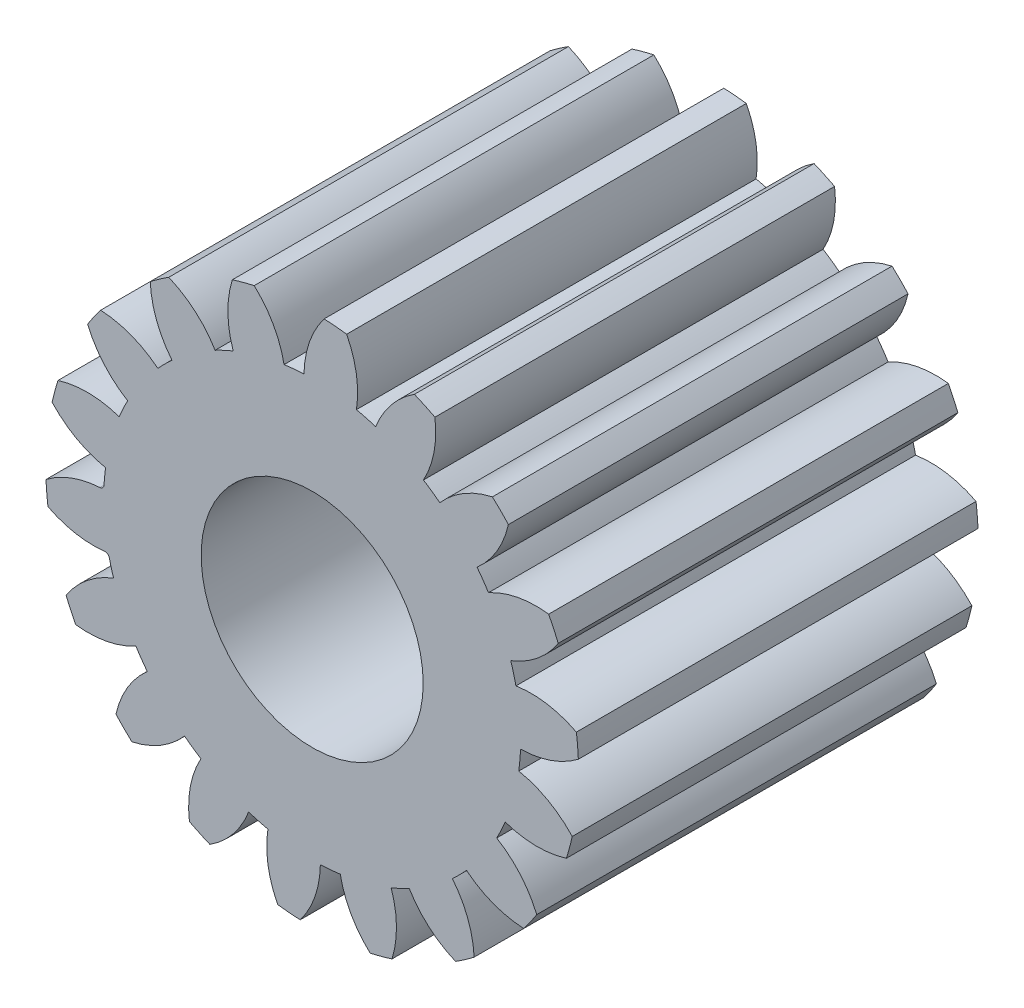
from build123d import *

# Parameters (mm, degrees)
BOSS_EXTRUDE3_DEPTH = 45
SKETCH2_R           = 23.476416667
BOSS_EXTRUDE4_DEPTH = 45
FILLET1_R           = 0.5
FILLET3_R           = 0.5
CIRPATTERN1_COUNT   = 18
SKETCH6_R           = 12.5
CUT_EXTRUDE1_DEPTH  = 45


with BuildPart() as part:
    # Sketch5 → Boss-Extrude3 (new body)
    with BuildSketch(Plane.XY):
        with BuildLine():
            ThreePointArc((-23.458215763, 0.924257933), (-26.894927841, 0.30989444), (-29.969912715, -1.343254201))
            ThreePointArc((-29.969912715, -1.343254201), (-29.885840943, -2.614672282), (-29.747856043, -3.881373576))
            ThreePointArc((-29.747856043, -3.881373576), (-26.43252085, -4.975441656), (-22.941337049, -4.983692796))
            ThreePointArc((-22.941337049, -4.983692796), (-23.387081814, -2.046104532), (-23.458215763, 0.924257933))
        make_face()
    boss_extrude3 = extrude(amount=BOSS_EXTRUDE3_DEPTH)

    # Sketch2 → Boss-Extrude4 (add)
    with BuildSketch(Plane.XY):
        Circle(SKETCH2_R)
    extrude(amount=BOSS_EXTRUDE4_DEPTH)

    # Fillet1
    fillet1_edges = [part.edges().sort_by_distance(p)[0] for p in [
        (-23.458215763, 0.924257933, 22.5),
    ]]
    fillet(fillet1_edges, radius=FILLET1_R)

    # Fillet3
    fillet3_edges = [part.edges().sort_by_distance(p)[0] for p in [
        (-22.941337049, -4.983692796, 22.5),
    ]]
    fillet(fillet3_edges, radius=FILLET3_R)

    # CirPattern1: Boss-Extrude3 ×18 about axis
    cirpattern1_axis = Axis((0, 0, 0), (0, 0, 1))
    for i in range(1, CIRPATTERN1_COUNT):
        add(boss_extrude3.rotate(cirpattern1_axis, i * 360 / CIRPATTERN1_COUNT))

    # Sketch6 → Cut-Extrude1 (cut)
    with BuildSketch(Plane.XY.offset(45)):
        Circle(SKETCH6_R)
    extrude(amount=-CUT_EXTRUDE1_DEPTH, mode=Mode.SUBTRACT)


solid = part.part
